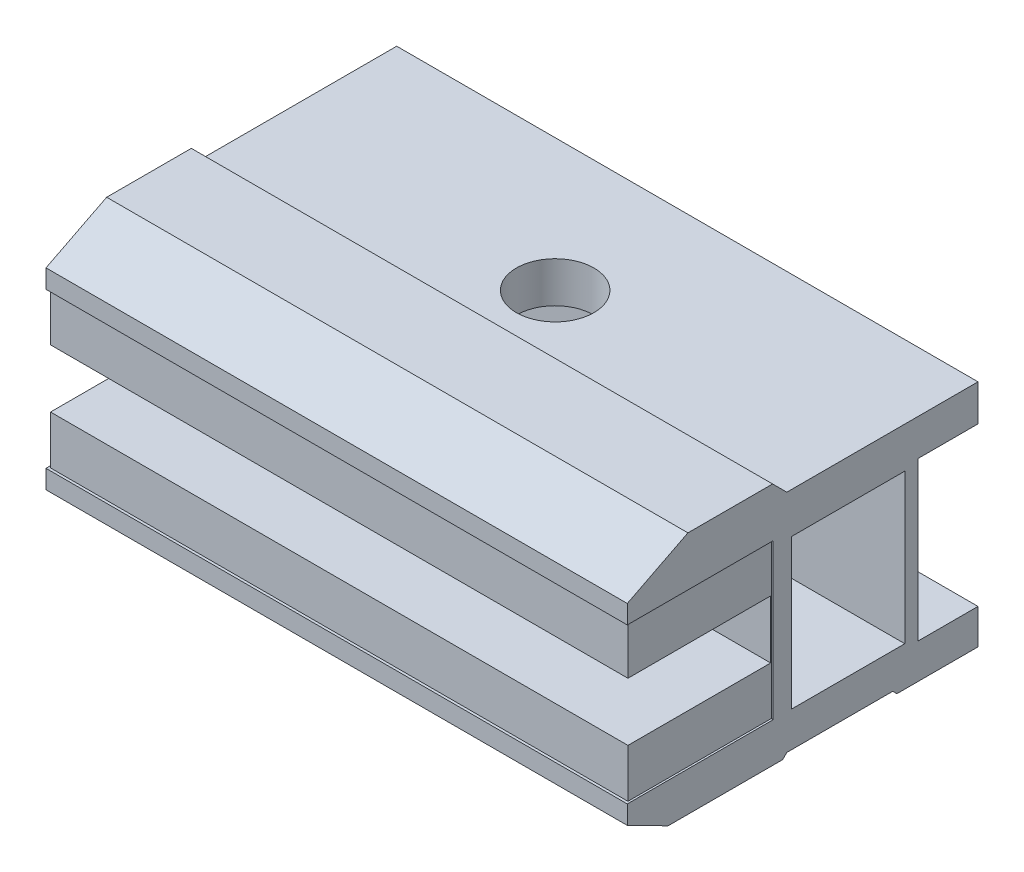
from build123d import *

# Parameters (mm, degrees)
CROQUIS1_W              = 11.672108333
CROQUIS1_H              = 15.427149297
SALIENTE_EXTRUIR1_DEPTH = 60
CROQUIS2_R              = 4
CORTAR_EXTRUIR1_DEPTH   = 60
CROQUIS5_W              = 60
CROQUIS5_H              = 14.732368319
SALIENTE_EXTRUIR4_DEPTH = 5
CROQUIS6_W              = 14.792406449
CROQUIS6_H              = 16
CORTAR_EXTRUIR2_DEPTH   = 0.2
CORTAR_EXTRUIR3_DEPTH   = 60
SALIENTE_EXTRUIR5_DEPTH = 60


with BuildPart() as part:
    # Croquis1 → Saliente-Extruir1 (new body)
    with BuildSketch(Plane(origin=(0, 0, 0), x_dir=(0, 0, -1), z_dir=(1, 0, 0))):
        Polygon((0, 23.023275897), (6.259402679, 26.20509842), (15, 26.20509842), (16.468373545, 24.736724875), (30, 24.736724875), (36.2, 24.736724875), (36.2, 20.972943127), (30, 20.972943127), (30, 4.65930459), (36.2, 4.65930459), (36.2, 1.468373545), (30, 1.468373545), (16.468373545, 1.468373545), (15, 0), (6.259402679, 0), (0, 3.181822522), (0, 5.10254921), (15, 5.10254921), (15, 21.10254921), (0, 21.10254921), align=None)
        with Locations((22.807201834, 12.816123859)):
            Rectangle(CROQUIS1_W, CROQUIS1_H, mode=Mode.SUBTRACT)
    extrude(amount=SALIENTE_EXTRUIR1_DEPTH)

    # Croquis2 → Cortar-Extruir1 (cut)
    with BuildSketch(Plane(origin=(0, 24.736724875, 0), x_dir=(1, 0, 0), z_dir=(0, 1, 0))):
        with Locations(Location((30, 22.555814773, 0), (0, 0, 270))):
            Circle(CROQUIS2_R)
    extrude(amount=-CORTAR_EXTRUIR1_DEPTH, mode=Mode.SUBTRACT)

    # Croquis5 → Saliente-Extruir4 (add)
    with BuildSketch(Plane(origin=(0, 5.10254921, 0), x_dir=(1, 0, 0), z_dir=(0, 1, 0))):
        with Locations((30, 7.633815841)):
            Rectangle(CROQUIS5_W, CROQUIS5_H)
    saliente_extruir4 = extrude(amount=SALIENTE_EXTRUIR4_DEPTH)

    # Simetría1: Saliente-Extruir4 across plane
    add(saliente_extruir4.mirror(Plane.ZX.offset(13.10254921)))

    # Croquis6 → Cortar-Extruir2 (cut)
    with BuildSketch(Plane(origin=(60, 0, 0), x_dir=(0, 0, -1), z_dir=(1, 0, 0))):
        with Locations((7.663834905, 13.10254921)):
            Rectangle(CROQUIS6_W, CROQUIS6_H)
    cortar_extruir2 = extrude(amount=-CORTAR_EXTRUIR2_DEPTH, mode=Mode.SUBTRACT)

    # Simetría2: Cortar-Extruir2 across plane
    add(cortar_extruir2.mirror(Plane(origin=(30, 0, 0), x_dir=(0, 0, 1), z_dir=(1, 0, 0))), mode=Mode.SUBTRACT)

    # Croquis7 → Cortar-Extruir3 (cut)
    with BuildSketch(Plane(origin=(60, 0, 0), x_dir=(0, 0, -1), z_dir=(1, 0, 0))):
        Polygon((16.040272261, 1.040272261), (4.212939392, 1.040272261), (2.720078376, -1.896540894), (18.763264408, -1.896540894), align=None)
    extrude(amount=-CORTAR_EXTRUIR3_DEPTH, mode=Mode.SUBTRACT)

    # Croquis8 → Saliente-Extruir5 (add)
    with BuildSketch(Plane.ZY):
        Polygon((-27.827964964, 1.040272261), (-36.2, 1.040272261), (-36.2, 1.468373545), (-27.399863681, 1.468373545), align=None)
    extrude(amount=-SALIENTE_EXTRUIR5_DEPTH)


solid = part.part
